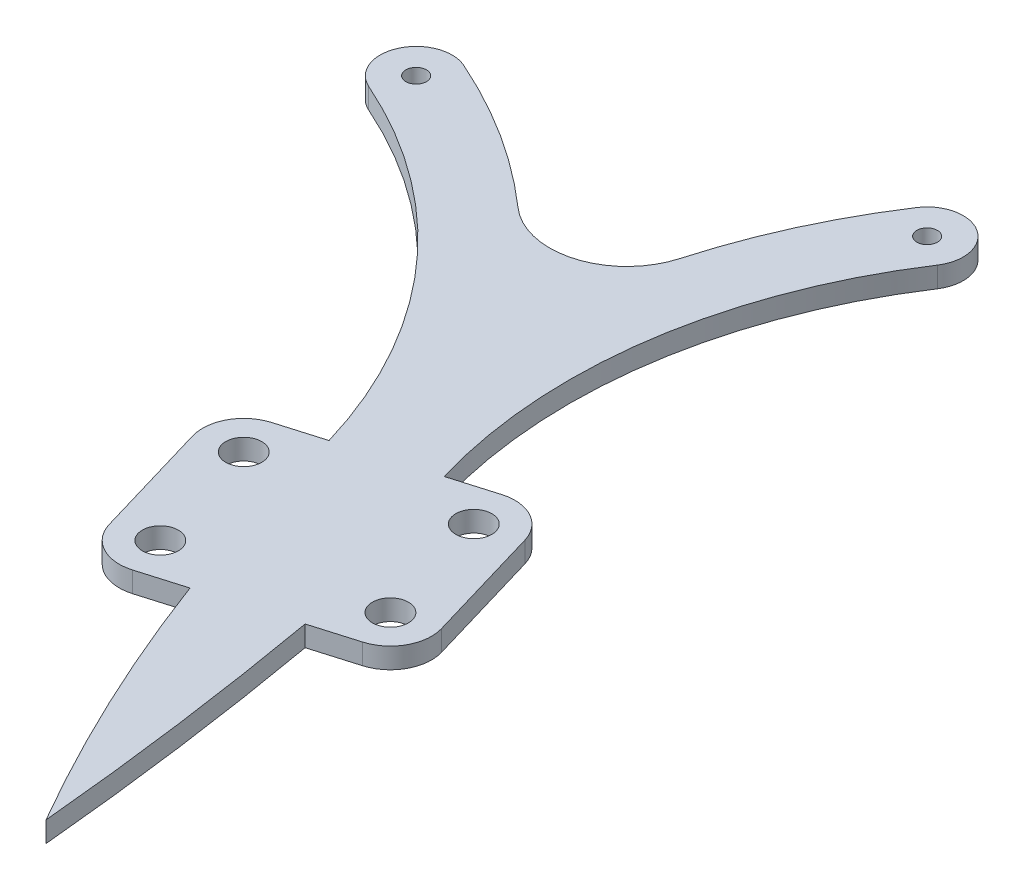
from build123d import *

# Parameters (mm, degrees)
ESQUISSE1_R        = 1
ESQUISSE1_R_2      = 1.75
BOSS_EXTRU_1_DEPTH = 2


with BuildPart() as part:
    # Esquisse1 → Boss.-Extru.1 (new body)
    with BuildSketch(Plane(origin=(-102.847426705, 0, 18.134776225), x_dir=(-0.9358900387216226, 0, 0.3522922585320884), z_dir=(0, -1, 0))):
        with BuildLine():
            Line((-29.681110437, -6.92992201), (-25.193077168, -6.601962606))
            ThreePointArc((-25.193077168, -6.601962606), (-31.376531627, 14.125140597), (-45.701784247, 30.331159651))
            ThreePointArc((-45.701784247, 30.331159651), (-46.468142588, 35.221220478), (-41.578081761, 35.987578819))
            ThreePointArc((-41.578081761, 35.987578819), (-34.948662945, 30.333854293), (-29.254192772, 23.739401754))
            ThreePointArc((-29.254192772, 23.739401754), (-22.67424344, 20.714879645), (-16.604130615, 24.664208385))
            ThreePointArc((-16.604130615, 24.664208385), (-11.931476736, 32.014751147), (-6.198466062, 38.571942755))
            ThreePointArc((-6.198466062, 38.571942755), (-1.248925128, 38.526726063), (-1.294141821, 33.577185129))
            ThreePointArc((-1.294141821, 33.577185129), (-13.111349847, 15.448077308), (-16.215278728, -5.968658704))
            Line((-16.215278728, -5.968658704), (-11.727259944, -5.640718208))
            ThreePointArc((-11.727259944, -5.640718208), (-8.820974111, -6.603051654), (-7.446392196, -9.338578579))
            Line((-7.446392196, -9.338578579), (-6.571881132, -21.306670758))
            ThreePointArc((-6.571881132, -21.306670758), (-7.534214578, -24.212956591), (-10.269741503, -25.587538506))
            Line((-10.269741503, -25.587538506), (-14.757760288, -25.915479002))
            ThreePointArc((-14.757760288, -25.915479002), (-15.331661084, -40.585109619), (-17.13310324, -55.155018018))
            ThreePointArc((-17.13310324, -55.155018018), (-20.734362801, -40.921154617), (-23.735479814, -26.548777137))
            Line((-23.735479814, -26.548777137), (-28.223513084, -26.876736542))
            ThreePointArc((-28.223513084, -26.876736542), (-31.129802724, -25.914414593), (-32.504395461, -23.178893106))
            Line((-32.504395461, -23.178893106), (-33.378953873, -11.210804387))
            ThreePointArc((-33.378953873, -11.210804387), (-32.416631925, -8.304514747), (-29.681110437, -6.92992201))
        make_face()
        with Locations(Location((-43.639933004, 33.159369235, 0), (0, 0, 110.627584138))):
            Circle(ESQUISSE1_R, mode=Mode.SUBTRACT)
        with Locations(Location((-29.389590967, -10.919284916, 0), (0, 0, 110.627584138))):
            Circle(ESQUISSE1_R_2, mode=Mode.SUBTRACT)
        with Locations(Location((-28.515032555, -22.887373635, 0), (0, 0, 110.627584138))):
            Circle(ESQUISSE1_R_2, mode=Mode.SUBTRACT)
        with Locations(Location((-10.561245191, -21.598174446, 0), (0, 0, 110.627584138))):
            Circle(ESQUISSE1_R_2, mode=Mode.SUBTRACT)
        with Locations(Location((-11.435756256, -9.630082268, 0), (0, 0, 110.627584138))):
            Circle(ESQUISSE1_R_2, mode=Mode.SUBTRACT)
        with Locations(Location((-3.746303941, 36.074563942, 0), (0, 0, 110.627584138))):
            Circle(ESQUISSE1_R, mode=Mode.SUBTRACT)
    extrude(amount=BOSS_EXTRU_1_DEPTH)


solid = part.part
